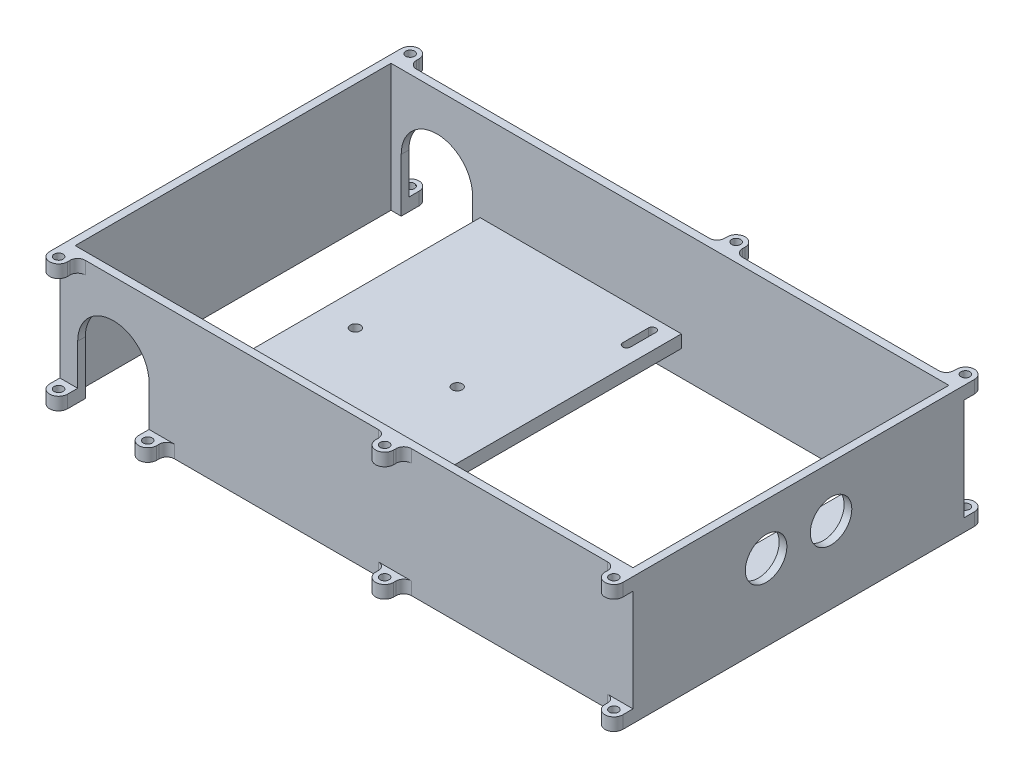
from build123d import *

# Parameters (mm, degrees)
SKETCH1_W           = 225
SKETCH1_H           = 130
SKETCH1_W_2         = 219
SKETCH1_H_2         = 124
BOSS_EXTRUDE1_DEPTH = 50
CUT_EXTRUDE1_DEPTH  = 180.988888546
SKETCH4_R           = 1.75
BOSS_EXTRUDE2_DEPTH = 5
SKETCH6_R           = 8.15
CUT_EXTRUDE2_DEPTH  = 10
BOSS_EXTRUDE5_START = -5
SKETCH8_R           = 1.75
BOSS_EXTRUDE5_DEPTH = 5
BOSS_EXTRUDE6_START = -10
SKETCH9_W           = 19
SKETCH9_H           = 124
SKETCH9_W_2         = 14
BOSS_EXTRUDE6_DEPTH = 5
FILLET1_R           = 3
SKETCH10_W          = 124
SKETCH10_H          = 5
BOSS_EXTRUDE7_DEPTH = 65
SKETCH11_R          = 2
CUT_EXTRUDE3_DEPTH  = 140.560918598


with BuildPart() as part:
    # Sketch1 → Boss-Extrude1 (new body)
    with BuildSketch(Plane(origin=(0, 0, 0), x_dir=(1, 0, 0), z_dir=(0, 1, 0))):
        with Locations((1.5, 0)):
            Rectangle(SKETCH1_W, SKETCH1_H)
        with Locations((1.5, 0)):
            Rectangle(SKETCH1_W_2, SKETCH1_H_2, mode=Mode.SUBTRACT)
    extrude(amount=BOSS_EXTRUDE1_DEPTH)

    # Sketch3 → Cut-Extrude1 (cut, through all)
    with BuildSketch(Plane.XY.offset(65)):
        with BuildLine():
            Line((-104, 0), (-76, 0))
            Line((-76, 0), (-76, 21))
            ThreePointArc((-76, 21), (-90, 35), (-104, 21))
            Line((-104, 21), (-104, 0))
        make_face()
    extrude(amount=-CUT_EXTRUDE1_DEPTH, mode=Mode.SUBTRACT)

    # Sketch4 → Boss-Extrude2 (add)
    # profile 1 of 8: a face of its own
    with BuildSketch(Plane.XZ):
        with BuildLine():
            Line((-111, 69), (-111, 65))
            Line((-111, 65), (-104, 65))
            Line((-104, 65), (-104, 69))
            ThreePointArc((-104, 69), (-107.5, 72.5), (-111, 69))
        make_face()
        with Locations(Location((-107.5, 69, 0), (0, 0, 270))):
            Circle(SKETCH4_R, mode=Mode.SUBTRACT)
    # profile 2 of 8: a face of its own
    with BuildSketch(Plane.XZ):
        with BuildLine():
            Line((-76, 69), (-76, 65))
            Line((-76, 65), (-69, 65))
            Line((-69, 65), (-69, 69))
            ThreePointArc((-69, 69), (-72.5, 72.5), (-76, 69))
        make_face()
        with Locations(Location((-72.5, 69, 0), (0, 0, 270))):
            Circle(SKETCH4_R, mode=Mode.SUBTRACT)
    # profile 3 of 8: a face of its own
    with BuildSketch(Plane.XZ):
        with BuildLine():
            Line((-76, -65), (-69, -65))
            Line((-69, -65), (-69, -69))
            ThreePointArc((-69, -69), (-72.5, -72.5), (-76, -69))
            Line((-76, -69), (-76, -65))
        make_face()
        with Locations(Location((-72.5, -69, 0), (0, 0, 90))):
            Circle(SKETCH4_R, mode=Mode.SUBTRACT)
    # profile 4 of 8: a face of its own
    with BuildSketch(Plane.XZ):
        with BuildLine():
            Line((-111, -65), (-104, -65))
            Line((-104, -65), (-104, -69))
            ThreePointArc((-104, -69), (-107.5, -72.5), (-111, -69))
            Line((-111, -69), (-111, -65))
        make_face()
        with Locations(Location((-107.5, -69, 0), (0, 0, 90))):
            Circle(SKETCH4_R, mode=Mode.SUBTRACT)
    # profile 5 of 8: a face of its own
    with BuildSketch(Plane.XZ):
        with BuildLine():
            Line((17, -65), (24, -65))
            Line((24, -65), (24, -69))
            ThreePointArc((24, -69), (20.5, -72.5), (17, -69))
            Line((17, -69), (17, -65))
        make_face()
        with Locations(Location((20.5, -69, 0), (0, 0, 90))):
            Circle(SKETCH4_R, mode=Mode.SUBTRACT)
    # profile 6 of 8: a face of its own
    with BuildSketch(Plane.XZ):
        with BuildLine():
            Line((107, -65), (114, -65))
            Line((114, -65), (114, -69))
            ThreePointArc((114, -69), (110.5, -72.5), (107, -69))
            Line((107, -69), (107, -65))
        make_face()
        with Locations(Location((110.5, -69, 0), (0, 0, 90))):
            Circle(SKETCH4_R, mode=Mode.SUBTRACT)
    # profile 7 of 8: a face of its own
    with BuildSketch(Plane.XZ):
        with BuildLine():
            Line((17, 69), (17, 65))
            Line((17, 65), (24, 65))
            Line((24, 65), (24, 69))
            ThreePointArc((24, 69), (20.5, 72.5), (17, 69))
        make_face()
        with Locations(Location((20.5, 69, 0), (0, 0, 270))):
            Circle(SKETCH4_R, mode=Mode.SUBTRACT)
    # profile 8 of 8: a face of its own
    with BuildSketch(Plane.XZ):
        with BuildLine():
            Line((107, 69), (107, 65))
            Line((107, 65), (114, 65))
            Line((114, 65), (114, 69))
            ThreePointArc((114, 69), (110.5, 72.5), (107, 69))
        make_face()
        with Locations(Location((110.5, 69, 0), (0, 0, 270))):
            Circle(SKETCH4_R, mode=Mode.SUBTRACT)
    extrude(amount=-BOSS_EXTRUDE2_DEPTH)

    # Sketch6 → Cut-Extrude2 (cut)
    with BuildSketch(Plane(origin=(114, 0, 0), x_dir=(0, 0, -1), z_dir=(1, 0, 0))):
        with Locations((-12.75, 30)):
            Circle(SKETCH6_R)
        with Locations((12.75, 30)):
            Circle(SKETCH6_R)
    extrude(amount=-CUT_EXTRUDE2_DEPTH, mode=Mode.SUBTRACT)

    # Sketch8 → Boss-Extrude5 (add)
    # profile 1 of 6: a face of its own
    with BuildSketch(Plane(origin=(0, 50, 0), x_dir=(1, 0, 0), z_dir=(0, 1, 0)).offset(BOSS_EXTRUDE5_START)):
        with BuildLine():
            Line((114, 65), (107, 65))
            Line((107, 65), (107, 69))
            ThreePointArc((107, 69), (110.5, 72.5), (114, 69))
            Line((114, 69), (114, 65))
        make_face()
        with Locations(Location((110.5, 69, 0), (0, 0, 270))):
            Circle(SKETCH8_R, mode=Mode.SUBTRACT)
    # profile 2 of 6: a face of its own
    with BuildSketch(Plane(origin=(0, 50, 0), x_dir=(1, 0, 0), z_dir=(0, 1, 0)).offset(BOSS_EXTRUDE5_START)):
        with BuildLine():
            Line((114, -65), (114, -69))
            ThreePointArc((114, -69), (110.5, -72.5), (107, -69))
            Line((107, -69), (107, -65))
            Line((107, -65), (114, -65))
        make_face()
        with Locations(Location((110.5, -69, 0), (0, 0, 90))):
            Circle(SKETCH8_R, mode=Mode.SUBTRACT)
    # profile 3 of 6: a face of its own
    with BuildSketch(Plane(origin=(0, 50, 0), x_dir=(1, 0, 0), z_dir=(0, 1, 0)).offset(BOSS_EXTRUDE5_START)):
        with BuildLine():
            Line((-104, 65), (-111, 65))
            Line((-111, 65), (-111, 69))
            ThreePointArc((-111, 69), (-107.5, 72.5), (-104, 69))
            Line((-104, 69), (-104, 65))
        make_face()
        with Locations(Location((-107.5, 69, 0), (0, 0, 270))):
            Circle(SKETCH8_R, mode=Mode.SUBTRACT)
    # profile 4 of 6: a face of its own
    with BuildSketch(Plane(origin=(0, 50, 0), x_dir=(1, 0, 0), z_dir=(0, 1, 0)).offset(BOSS_EXTRUDE5_START)):
        with BuildLine():
            Line((24, 65), (17, 65))
            Line((17, 65), (17, 69))
            ThreePointArc((17, 69), (20.5, 72.5), (24, 69))
            Line((24, 69), (24, 65))
        make_face()
        with Locations(Location((20.5, 69, 0), (0, 0, 270))):
            Circle(SKETCH8_R, mode=Mode.SUBTRACT)
    # profile 5 of 6: a face of its own
    with BuildSketch(Plane(origin=(0, 50, 0), x_dir=(1, 0, 0), z_dir=(0, 1, 0)).offset(BOSS_EXTRUDE5_START)):
        with BuildLine():
            Line((24, -65), (24, -69))
            ThreePointArc((24, -69), (20.5, -72.5), (17, -69))
            Line((17, -69), (17, -65))
            Line((17, -65), (24, -65))
        make_face()
        with Locations(Location((20.5, -69, 0), (0, 0, 90))):
            Circle(SKETCH8_R, mode=Mode.SUBTRACT)
    # profile 6 of 6: a face of its own
    with BuildSketch(Plane(origin=(0, 50, 0), x_dir=(1, 0, 0), z_dir=(0, 1, 0)).offset(BOSS_EXTRUDE5_START)):
        with BuildLine():
            Line((-111, -65), (-104, -65))
            Line((-104, -65), (-104, -69))
            ThreePointArc((-104, -69), (-107.5, -72.5), (-111, -69))
            Line((-111, -69), (-111, -65))
        make_face()
        with Locations(Location((-107.5, -69, 0), (0, 0, 90))):
            Circle(SKETCH8_R, mode=Mode.SUBTRACT)
    extrude(amount=BOSS_EXTRUDE5_DEPTH)

    # Sketch9 → Boss-Extrude6 (add)
    # profile 1 of 2: a face of its own
    with BuildSketch(Plane.XZ.offset(BOSS_EXTRUDE6_START)):
        with Locations((101.5, 0)):
            Rectangle(SKETCH9_W, SKETCH9_H)
        with BuildLine():
            Line((97.5, 57.5), (97.5, 47.5))
            ThreePointArc((97.5, 47.5), (99, 46), (100.5, 47.5))
            Line((100.5, 47.5), (100.5, 57.5))
            ThreePointArc((100.5, 57.5), (99, 59), (97.5, 57.5))
        make_face(mode=Mode.SUBTRACT)
        with BuildLine():
            Line((100.5, -47.5), (100.5, -57.5))
            ThreePointArc((100.5, -57.5), (99, -59), (97.5, -57.5))
            Line((97.5, -57.5), (97.5, -47.5))
            ThreePointArc((97.5, -47.5), (99, -46), (100.5, -47.5))
        make_face(mode=Mode.SUBTRACT)
    # profile 2 of 2: a face of its own
    with BuildSketch(Plane.XZ.offset(BOSS_EXTRUDE6_START)):
        with Locations((-1, 0)):
            Rectangle(SKETCH9_W_2, SKETCH9_H)
        with BuildLine():
            Line((-2.5, 57.5), (-2.5, 47.5))
            ThreePointArc((-2.5, 47.5), (-1, 46), (0.5, 47.5))
            Line((0.5, 47.5), (0.5, 57.5))
            ThreePointArc((0.5, 57.5), (-1, 59), (-2.5, 57.5))
        make_face(mode=Mode.SUBTRACT)
        with BuildLine():
            Line((-2.5, -47.5), (-2.5, -57.5))
            ThreePointArc((-2.5, -57.5), (-1, -59), (0.5, -57.5))
            Line((0.5, -57.5), (0.5, -47.5))
            ThreePointArc((0.5, -47.5), (-1, -46), (-2.5, -47.5))
        make_face(mode=Mode.SUBTRACT)
    extrude(amount=-BOSS_EXTRUDE6_DEPTH)

    # Fillet1
    fillet1_edges = [part.edges().sort_by_distance(p)[0] for p in [
        (17, 2.5, -65),
        (24, 2.5, -65),
        (107, 2.5, -65),
        (24, 2.5, 65),
        (17, 2.5, 65),
        (107, 2.5, 65),
        (107, 47.5, -65),
        (107, 47.5, 65),
        (-104, 47.5, -65),
        (24, 47.5, -65),
        (17, 47.5, -65),
        (17, 47.5, 65),
        (24, 47.5, 65),
        (-104, 47.5, 65),
        (-69, 2.5, 65),
        (-69, 2.5, -65),
    ]]
    fillet(fillet1_edges, radius=FILLET1_R)

    # Sketch10 → Boss-Extrude7 (add)
    with BuildSketch(Plane.ZY.offset(8)):
        with Locations((0, 12.5)):
            Rectangle(SKETCH10_W, SKETCH10_H)
    extrude(amount=BOSS_EXTRUDE7_DEPTH)

    # Sketch11 → Cut-Extrude3 (cut, through all)
    with BuildSketch(Plane(origin=(0, 15, 0), x_dir=(1, 0, 0), z_dir=(0, 1, 0))):
        with Locations(Location((-60, 0, 0), (0, 0, 270))):
            Circle(SKETCH11_R)
        with Locations(Location((-20, 0, 0), (0, 0, 270))):
            Circle(SKETCH11_R)
    extrude(amount=-CUT_EXTRUDE3_DEPTH, mode=Mode.SUBTRACT)


solid = part.part
